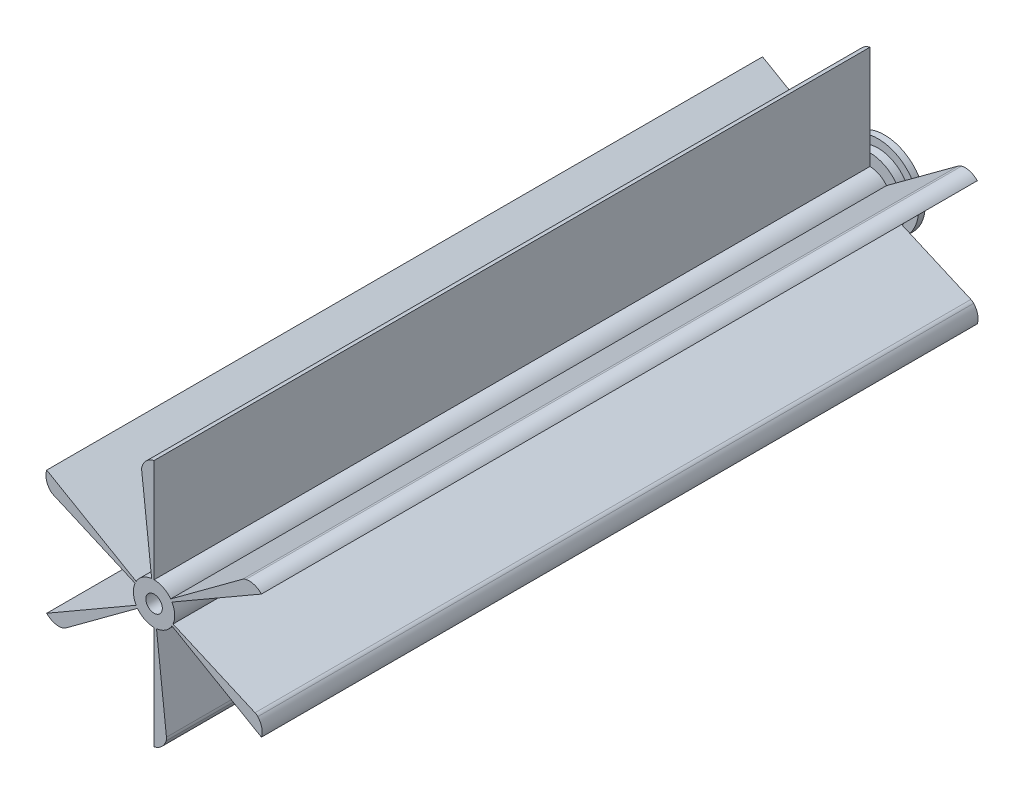
from build123d import *

# Parameters (mm, degrees)
SKETCH1_R           = 6.35
BOSS_EXTRUDE5_DEPTH = 220
SKETCH9_R           = 10
BOSS_EXTRUDE6_DEPTH = 2.5
SKETCH10_R          = 12.5
BOSS_EXTRUDE7_DEPTH = 2
SKETCH7_R           = 2.54
CUT_EXTRUDE1_DEPTH  = 19
CUT_EXTRUDE2_DEPTH  = 19


with BuildPart() as part:
    # Sketch1 → Boss-Extrude5 (new body)
    with BuildSketch(Plane.XY):
        Circle(SKETCH1_R)
        with BuildLine():
            ThreePointArc((0.744012112, -6.306262441), (0.372648292, -6.33905618), (0, -6.35))
            Line((0, -6.35), (0, -38.1))
            ThreePointArc((0, -38.1), (2.307620454, -36.88268092), (3.706666044, -34.680488981))
            ThreePointArc((3.706666044, -34.680488981), (3.812853299, -34.161384534), (3.809033576, -33.631544397))
            Line((3.809033576, -33.631544397), (0.744012112, -6.306262441))
        make_face()
        with BuildLine():
            ThreePointArc((-5.089377421, -3.79746461), (-5.303459542, -3.492250977), (-5.499261314, -3.175))
            Line((-5.499261314, -3.175), (-32.995567884, -19.05))
            ThreePointArc((-32.995567884, -19.05), (-30.78752841, -20.439798395), (-28.180851452, -20.550311448))
            ThreePointArc((-28.180851452, -20.550311448), (-27.678200185, -20.382720085), (-27.221255028, -20.114492039))
            Line((-27.221255028, -20.114492039), (-5.089377421, -3.79746461))
        make_face()
        with BuildLine():
            ThreePointArc((-5.833389533, 2.508797831), (-5.676107834, 2.846805203), (-5.499261314, 3.175))
            Line((-5.499261314, 3.175), (-32.995567884, 19.05))
            ThreePointArc((-32.995567884, 19.05), (-33.095148863, 16.442882525), (-31.887517495, 14.130177533))
            ThreePointArc((-31.887517495, 14.130177533), (-31.491053484, 13.778664449), (-31.030288604, 13.517052358))
            Line((-31.030288604, 13.517052358), (-5.833389533, 2.508797831))
        make_face()
        with BuildLine():
            Line((-3.809033576, 33.631544397), (-0.744012112, 6.306262441))
            ThreePointArc((-0.744012112, 6.306262441), (-0.372648292, 6.33905618), (0, 6.35))
            Line((0, 6.35), (0, 38.1))
            ThreePointArc((0, 38.1), (-2.307620454, 36.88268092), (-3.706666044, 34.680488981))
            ThreePointArc((-3.706666044, 34.680488981), (-3.812853299, 34.161384534), (-3.809033576, 33.631544397))
        make_face()
        with BuildLine():
            Line((27.221255028, 20.114492039), (5.089377421, 3.79746461))
            ThreePointArc((5.089377421, 3.79746461), (5.303459542, 3.492250977), (5.499261314, 3.175))
            Line((5.499261314, 3.175), (32.995567884, 19.05))
            ThreePointArc((32.995567884, 19.05), (30.78752841, 20.439798395), (28.180851452, 20.550311448))
            ThreePointArc((28.180851452, 20.550311448), (27.678200185, 20.382720085), (27.221255028, 20.114492039))
        make_face()
        with BuildLine():
            Line((31.030288604, -13.517052358), (5.833389533, -2.508797831))
            ThreePointArc((5.833389533, -2.508797831), (5.676107834, -2.846805203), (5.499261314, -3.175))
            Line((5.499261314, -3.175), (32.995567884, -19.05))
            ThreePointArc((32.995567884, -19.05), (33.095148863, -16.442882525), (31.887517495, -14.130177533))
            ThreePointArc((31.887517495, -14.130177533), (31.491053484, -13.778664449), (31.030288604, -13.517052358))
        make_face()
    extrude(amount=BOSS_EXTRUDE5_DEPTH)

    # Sketch9 → Boss-Extrude6 (add)
    with BuildSketch(Plane(origin=(0, 0, 0), x_dir=(-1, 0, 0), z_dir=(0, 0, -1))):
        with Locations(Location((0, 0, 0), (0, 0, 203.391310961))):
            Circle(SKETCH9_R)
    extrude(amount=BOSS_EXTRUDE6_DEPTH)

    # Sketch10 → Boss-Extrude7 (add)
    with BuildSketch(Plane(origin=(0, 0, -2.5), x_dir=(-1, 0, 0), z_dir=(0, 0, -1))):
        Circle(SKETCH10_R)
    extrude(amount=BOSS_EXTRUDE7_DEPTH)

    # Sketch7 → Cut-Extrude1 (cut)
    with BuildSketch(Plane.XY.offset(220)):
        Circle(SKETCH7_R)
    extrude(amount=-CUT_EXTRUDE1_DEPTH, mode=Mode.SUBTRACT)

    # Sketch11 → Cut-Extrude2 (cut)
    with BuildSketch(Plane(origin=(0, 0, -4.5), x_dir=(-1, 0, 0), z_dir=(0, 0, -1))):
        with BuildLine():
            Line((-1.12, 1.042353107), (1.12, 1.042353107))
            ThreePointArc((1.12, 1.042353107), (0, -1.53), (-1.12, 1.042353107))
        make_face()
    extrude(amount=-CUT_EXTRUDE2_DEPTH, mode=Mode.SUBTRACT)


solid = part.part
